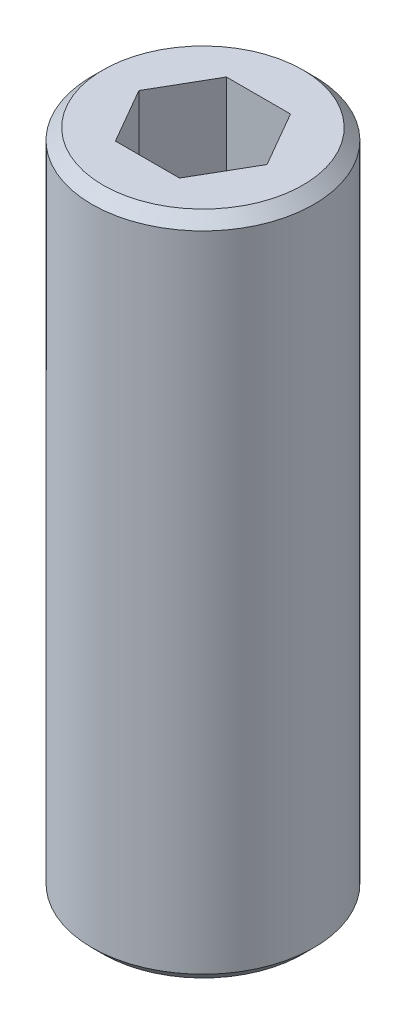
from build123d import *

# Parameters (mm, degrees)
SKETCH_1_R          = 2
EXTRUDE_1_DEPTH     = 12
CHAMFER_1_SIZE      = 0.2
CUT_EXTRUDE_1_DEPTH = 5


with BuildPart() as part:
    # 草图1 → 凸台-拉伸1 (new body)
    with BuildSketch(Plane(origin=(0, 0, 0), x_dir=(1, 0, 0), z_dir=(0, 1, 0))):
        with Locations(Location((0, 0, 0), (0, 0, 270))):
            Circle(SKETCH_1_R)
    extrude(amount=EXTRUDE_1_DEPTH)

    # 倒角1
    chamfer_1_edges = [part.edges().sort_by_distance(p)[0] for p in [
        (0, 0, -2),
        (0, 12, -2),
    ]]
    chamfer(chamfer_1_edges, length=CHAMFER_1_SIZE)

    # 草图2 → 切除-拉伸1 (cut)
    with BuildSketch(Plane(origin=(0, 12, 0), x_dir=(1, 0, 0), z_dir=(0, 1, 0))):
        Polygon((-1.154700538, 0), (-0.577350269, -1), (0.577350269, -1), (1.154700538, 0), (0.577350269, 1), (-0.577350269, 1), align=None)
    extrude(amount=-CUT_EXTRUDE_1_DEPTH, mode=Mode.SUBTRACT)


solid = part.part
